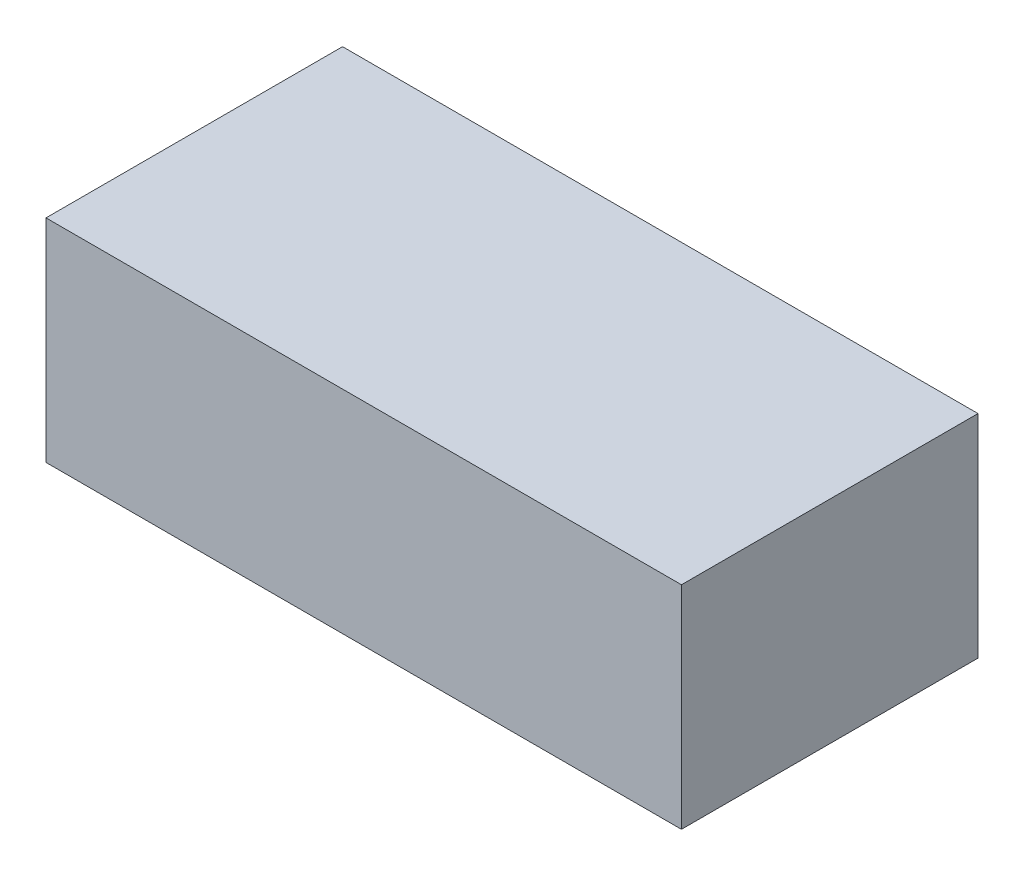
from build123d import *

# Parameters (mm, degrees)
CROQUIS2_W              = 75
CROQUIS2_H              = 25
SALIENTE_EXTRUIR1_DEPTH = 35


with BuildPart() as part:
    # Croquis2 → Saliente-Extruir1 (new body)
    with BuildSketch(Plane.XY):
        with Locations((37.5, 12.5)):
            Rectangle(CROQUIS2_W, CROQUIS2_H)
    extrude(amount=SALIENTE_EXTRUIR1_DEPTH)


solid = part.part
